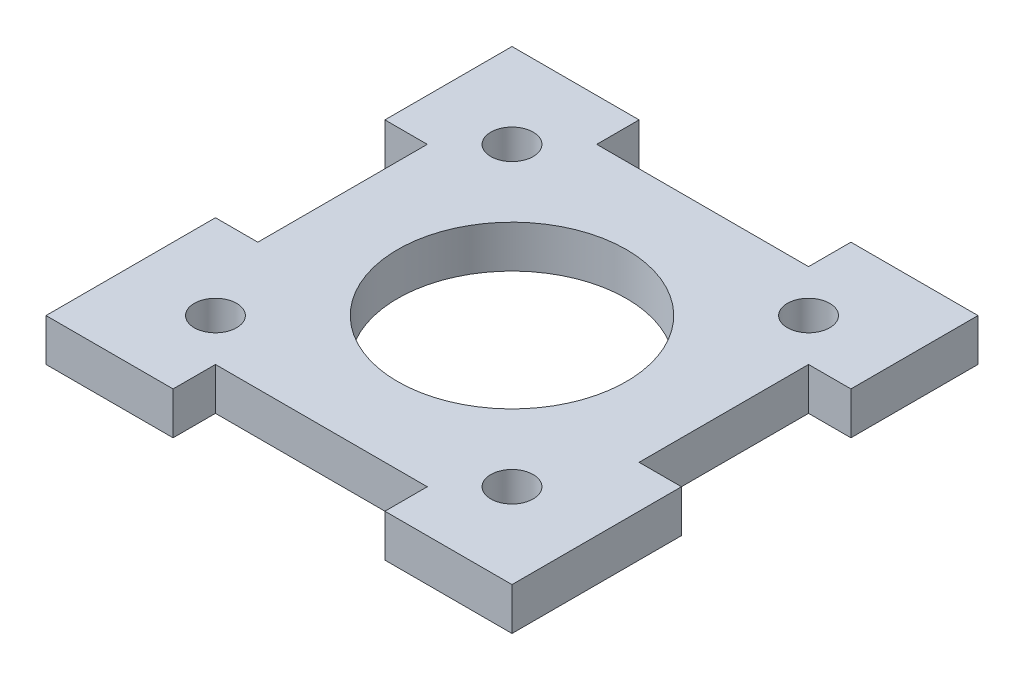
from build123d import *

# Parameters (mm, degrees)
ESQUISSE1_R        = 2.5
ESQUISSE1_R_2      = 13.5
BOSS_EXTRU_1_DEPTH = 5


with BuildPart() as part:
    # Esquisse1 → Boss.-Extru.1 (new body)
    with BuildSketch(Plane(origin=(0, 0, 0), x_dir=(1, 0, 0), z_dir=(0, 1, 0))):
        Polygon((-12.5, 27.5), (-12.5, 22.5), (12.5, 22.5), (12.5, 27.5), (27.5, 27.5), (27.5, 12.5), (22.5, 12.5), (22.5, -7.5), (27.5, -7.5), (27.5, -27.5), (12.5, -27.5), (12.5, -22.5), (-12.5, -22.5), (-12.5, -27.5), (-27.5, -27.5), (-27.5, -7.5), (-22.5, -7.5), (-22.5, 12.5), (-27.5, 12.5), (-27.5, 27.5), align=None)
        with Locations(Location((17.5, 17.5, 0), (0, 0, 270))):
            Circle(ESQUISSE1_R, mode=Mode.SUBTRACT)
        with Locations(Location((-17.5, 17.5, 0), (0, 0, 90))):
            Circle(ESQUISSE1_R, mode=Mode.SUBTRACT)
        with Locations(Location((-17.5, -17.5, 0), (0, 0, 270))):
            Circle(ESQUISSE1_R, mode=Mode.SUBTRACT)
        with Locations(Location((17.5, -17.5, 0), (0, 0, 90))):
            Circle(ESQUISSE1_R, mode=Mode.SUBTRACT)
        with Locations(Location((0, 0, 0), (0, 0, 270))):
            Circle(ESQUISSE1_R_2, mode=Mode.SUBTRACT)
    extrude(amount=BOSS_EXTRU_1_DEPTH)


solid = part.part
